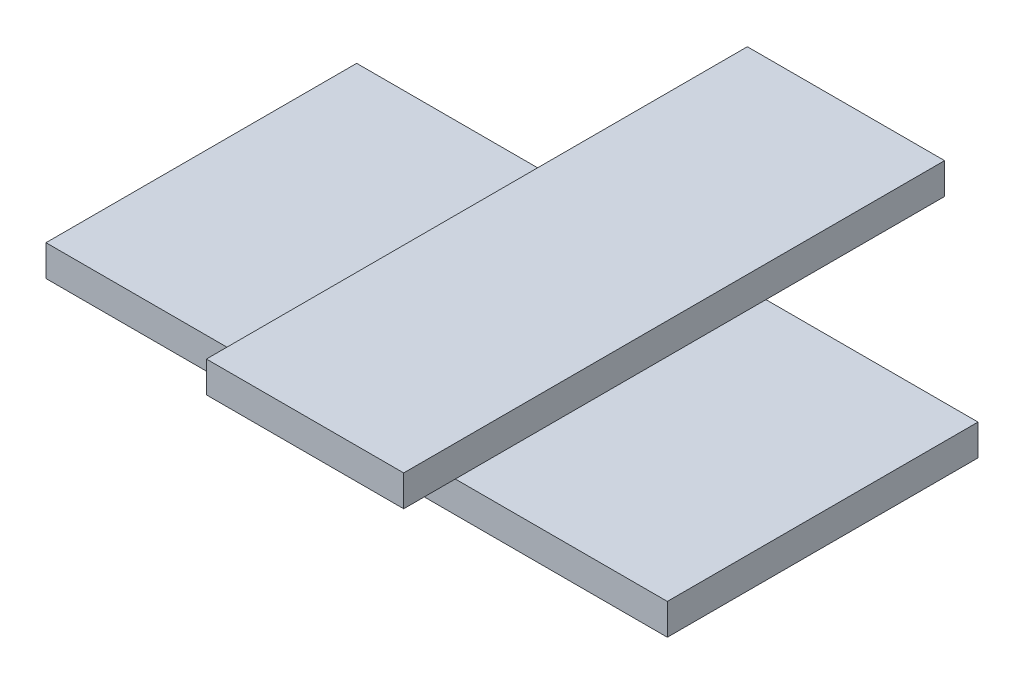
from build123d import *

# Parameters (mm, degrees)
SKETCH1_W           = 200
SKETCH1_H           = 100
BOSS_EXTRUDE1_DEPTH = 10
SKETCH2_W           = 63.5
SKETCH2_H           = 174.117508
BOSS_EXTRUDE2_DEPTH = 10


with BuildPart() as part:
    # Sketch1 → Boss-Extrude1 (new body)
    with BuildSketch(Plane(origin=(0, 0, 0), x_dir=(1, 0, 0), z_dir=(0, 1, 0))):
        with Locations((100, 50)):
            Rectangle(SKETCH1_W, SKETCH1_H)
    extrude(amount=BOSS_EXTRUDE1_DEPTH)

    # Sketch2 → Boss-Extrude2 (add)
    with BuildSketch(Plane(origin=(0, 10, 0), x_dir=(1, 0, 0), z_dir=(0, 1, 0))):
        with Locations((100, 70.447060463)):
            Rectangle(SKETCH2_W, SKETCH2_H)
    extrude(amount=BOSS_EXTRUDE2_DEPTH)


solid = part.part
